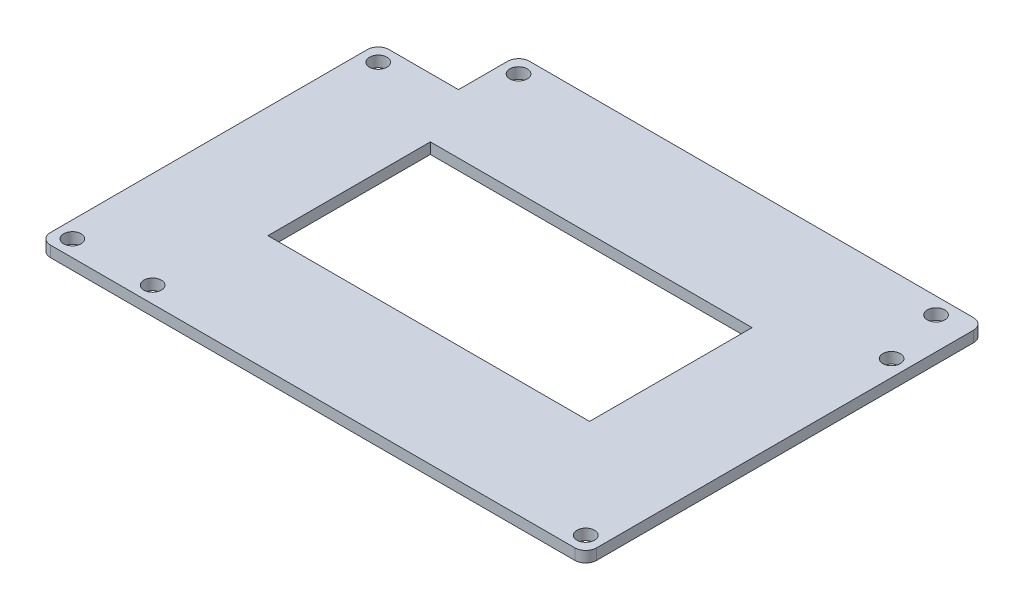
from build123d import *

# Parameters (mm, degrees)
SKETCH_1_R          = 1.6
EXTRUDE_1_DEPTH     = 2
CUT_EXTRUDE_1_REACH = 67.33
SKETCH_2_W          = 58.902173398
SKETCH_2_H          = 29.745647313


with BuildPart() as part:
    # 草图1 → 凸台-拉伸1 (new body)
    # profile 1 of 3: a face of its own
    with BuildSketch(Plane(origin=(0, 0, 0), x_dir=(1, 0, 0), z_dir=(0, 1, 0))):
        with BuildLine():
            Line((-35.3, -31), (48, -31))
            ThreePointArc((48, -31), (49.414213562, -30.414213562), (50, -29))
            Line((50, -29), (50, 29))
            ThreePointArc((50, 29), (49.414213562, 30.414213562), (48, 31))
            Line((48, 31), (-35.3, 31))
            Line((-35.3, 31), (-35.3, -31))
        make_face()
        with Locations(Location((-32.3, -28, 0), (0, 0, 270))):
            Circle(SKETCH_1_R, mode=Mode.SUBTRACT)
        with Locations(Location((47, -28, 0), (0, 0, 270))):
            Circle(SKETCH_1_R, mode=Mode.SUBTRACT)
        with Locations(Location((47, 28, 0), (0, 0, 270))):
            Circle(SKETCH_1_R, mode=Mode.SUBTRACT)
    # profile 2 of 3: a face of its own
    with BuildSketch(Plane(origin=(0, 0, 0), x_dir=(1, 0, 0), z_dir=(0, 1, 0))):
        with BuildLine():
            Line((-48, -31), (-35.3, -31))
            Line((-35.3, -31), (-35.3, 31))
            Line((-35.3, 31), (-48, 31))
            ThreePointArc((-48, 31), (-49.414213562, 30.414213562), (-50, 29))
            Line((-50, 29), (-50, -29))
            ThreePointArc((-50, -29), (-49.414213562, -30.414213562), (-48, -31))
        make_face()
        with Locations(Location((-47, -28, 0), (0, 0, 270))):
            Circle(SKETCH_1_R, mode=Mode.SUBTRACT)
        with Locations(Location((-47, 28, 0), (0, 0, 270))):
            Circle(SKETCH_1_R, mode=Mode.SUBTRACT)
    # profile 3 of 3: a face of its own
    with BuildSketch(Plane(origin=(0, 0, 0), x_dir=(1, 0, 0), z_dir=(0, 1, 0))):
        with BuildLine():
            Line((-35.3, 40), (-35.3, 31))
            Line((-35.3, 31), (48, 31))
            ThreePointArc((48, 31), (49.414213562, 30.414213562), (50, 29))
            Line((50, 29), (50, 40))
            ThreePointArc((50, 40), (49.414213562, 41.414213562), (48, 42))
            Line((48, 42), (-33.3, 42))
            ThreePointArc((-33.3, 42), (-34.714213562, 41.414213562), (-35.3, 40))
        make_face()
        with Locations(Location((-32.3, 39, 0), (0, 0, 270))):
            Circle(SKETCH_1_R, mode=Mode.SUBTRACT)
        with Locations(Location((44.144452232, 39, 0), (0, 0, 270))):
            Circle(SKETCH_1_R, mode=Mode.SUBTRACT)
    extrude(amount=EXTRUDE_1_DEPTH)

    # 草图2 → 切除-拉伸1 (cut, up to next)
    with BuildSketch(Plane(origin=(0, 2, 0), x_dir=(1, 0, 0), z_dir=(0, 1, 0)), mode=Mode.PRIVATE) as cut_extrude_1_sk1:
        with Locations((-0.141416386, 5.269425073)):
            Rectangle(SKETCH_2_W, SKETCH_2_H)
    cut_extrude_1_tool1 = extrude(cut_extrude_1_sk1.sketch, amount=-CUT_EXTRUDE_1_REACH, mode=Mode.PRIVATE) & part.part
    add(cut_extrude_1_tool1.solids().sort_by_distance((-0.141416, 2, -5.269425))[0], mode=Mode.SUBTRACT)


solid = part.part
